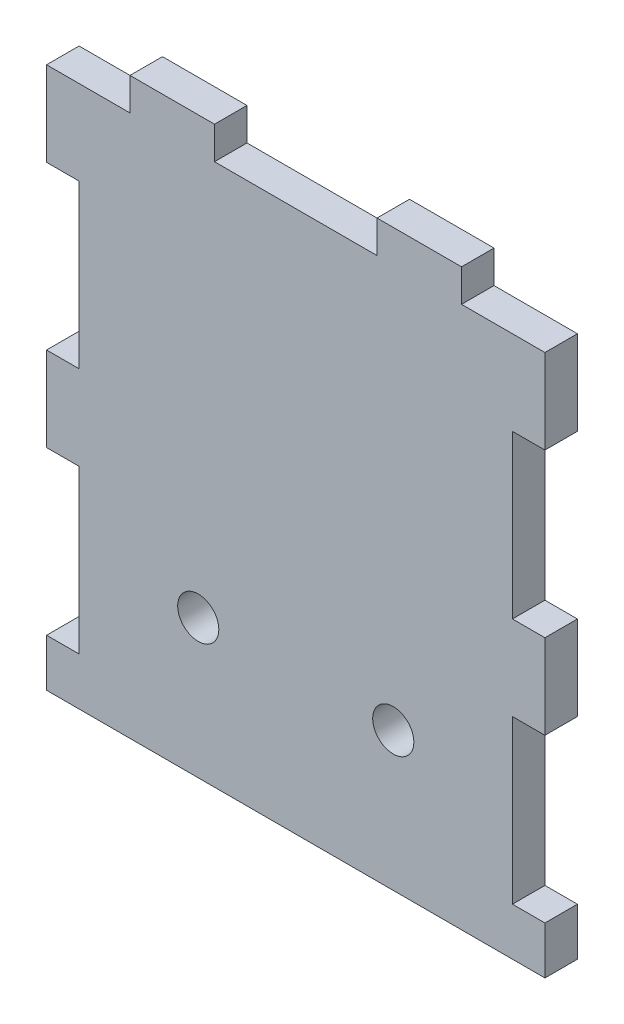
from build123d import *

# Parameters (mm, degrees)
SKETCH1_W             = 46
SKETCH1_H             = 50
BOSS_EXTRUDE1_DEPTH   = 3
SKETCH2_W             = 3
SKETCH2_H             = 15
CUT_EXTRUDE1_DEPTH    = 53.999062732
LPATTERN1_COUNT       = 3
LPATTERN1_PITCH       = 22.8
SKETCH3_W             = 7.8
SKETCH3_H             = 3
BOSS_EXTRUDE2_DEPTH   = 3
LPATTERN2_COUNT       = 2
LPATTERN2_PITCH       = 22.8
F_6_CLEARANCE_HOLE1_D = 3.7973


with BuildPart() as part:
    # Sketch1 → Boss-Extrude1 (new body)
    with BuildSketch(Plane.XY):
        with Locations((-17.993460648, -8.457986111)):
            Rectangle(SKETCH1_W, SKETCH1_H)
    extrude(amount=BOSS_EXTRUDE1_DEPTH)

    # Sketch2 → Cut-Extrude1 (cut, through all)
    with BuildSketch(Plane.XY.offset(3)):
        with Locations((-39.493460648, 1.242013889)):
            Rectangle(SKETCH2_W, SKETCH2_H)
        with Locations((3.506539352, 1.242013889)):
            Rectangle(SKETCH2_W, SKETCH2_H)
    cut_extrude1 = extrude(amount=-CUT_EXTRUDE1_DEPTH, mode=Mode.SUBTRACT)

    # LPattern1: Cut-Extrude1 ×3
    with Locations(*[(0, -i * LPATTERN1_PITCH, 0) for i in range(1, LPATTERN1_COUNT)]):
        add(cut_extrude1, mode=Mode.SUBTRACT)

    # Sketch3 → Boss-Extrude2 (add)
    with BuildSketch(Plane(origin=(0, 16.542013889, 0), x_dir=(1, 0, 0), z_dir=(0, 1, 0))):
        with Locations((-29.393460648, -1.5)):
            Rectangle(SKETCH3_W, SKETCH3_H)
    boss_extrude2 = extrude(amount=BOSS_EXTRUDE2_DEPTH)

    # LPattern2: Boss-Extrude2 ×2
    with Locations(*[(i * LPATTERN2_PITCH, 0, 0) for i in range(1, LPATTERN2_COUNT)]):
        add(boss_extrude2)

    # #6 Clearance Hole1 (through all)
    with Locations(Plane.XY.offset(3)):
        with Locations((-8.993460648, -20.657986111), (-26.993460648, -20.657986111)):
            Hole(F_6_CLEARANCE_HOLE1_D / 2)


solid = part.part
